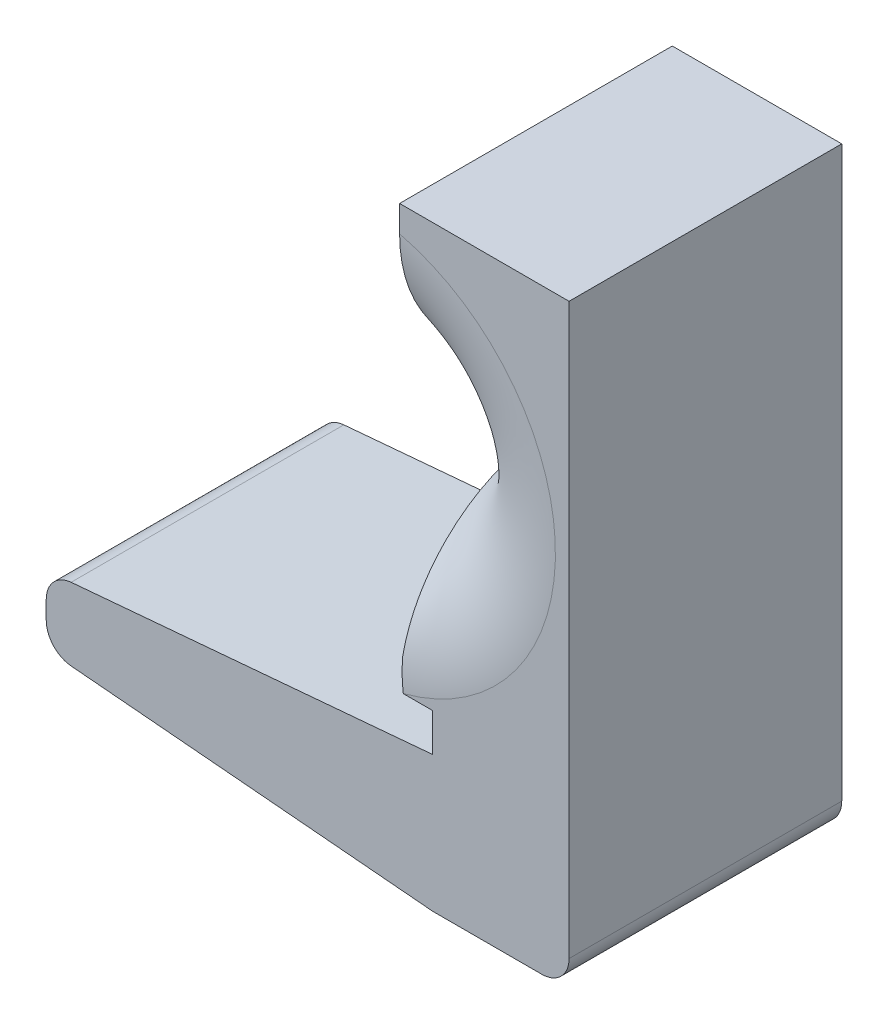
from build123d import *

# Parameters (mm, degrees)
BOSS_EXTRUDE1_DEPTH = 10
BOSS_EXTRUDE2_DEPTH = 2.429285786
FILLET2_R           = 2


with BuildPart() as part:
    # Sketch2 → Boss-Extrude1 (new, symmetric)
    with BuildSketch(Plane.XY):
        Polygon((41.051421481, -27.990049876), (41.051421481, -48.990049876), (43.480707267, -48.990049876), (43.480707267, -61.778339755), (15.134736917, -64.258290817), (15.134736917, -69.258290817), (43.480707267, -71.738241879), (53.480707267, -71.738241879), (53.480707267, -27.990049876), align=None)
    extrude(amount=BOSS_EXTRUDE1_DEPTH, both=True)

    # Sketch4 → Boss-Extrude2 (add)
    with BuildSketch(Plane.ZY.offset(-43.480707267)):
        with BuildLine():
            Line((-10, -48.990049876), (-10, -58.990049876))
            ThreePointArc((-10, -58.990049876), (-7.071067812, -51.918982064), (0, -48.990049876))
            Line((0, -48.990049876), (-10, -48.990049876))
        make_face()
        with BuildLine():
            Line((10, -48.990049876), (0, -48.990049876))
            ThreePointArc((0, -48.990049876), (7.071067812, -51.918982064), (10, -58.990049876))
            Line((10, -58.990049876), (10, -48.990049876))
        make_face()
    extrude(amount=BOSS_EXTRUDE2_DEPTH)

    # Sketch3 → Cut-Revolve1 (revolve, cut)
    with BuildSketch(Plane.ZY.offset(-37.480707267)):
        with BuildLine():
            Line((-10, -44.490049876), (10, -44.490049876))
            Line((10, -44.490049876), (10, -29.490049876))
            ThreePointArc((10, -29.490049876), (0, -39.490049876), (-10, -29.490049876))
            Line((-10, -29.490049876), (-10, -44.490049876))
        make_face()
    revolve(axis=Axis((37.480707267, -44.490049876, -10), (0, 0, 1)), mode=Mode.SUBTRACT)

    # Fillet2
    fillet2_edges = [part.edges().sort_by_distance(p)[0] for p in [
        (53.480707267, -71.738241879, 0),
        (15.134736917, -69.258290817, 0),
        (15.134736917, -64.258290817, 0),
    ]]
    fillet(fillet2_edges, radius=FILLET2_R)


solid = part.part
